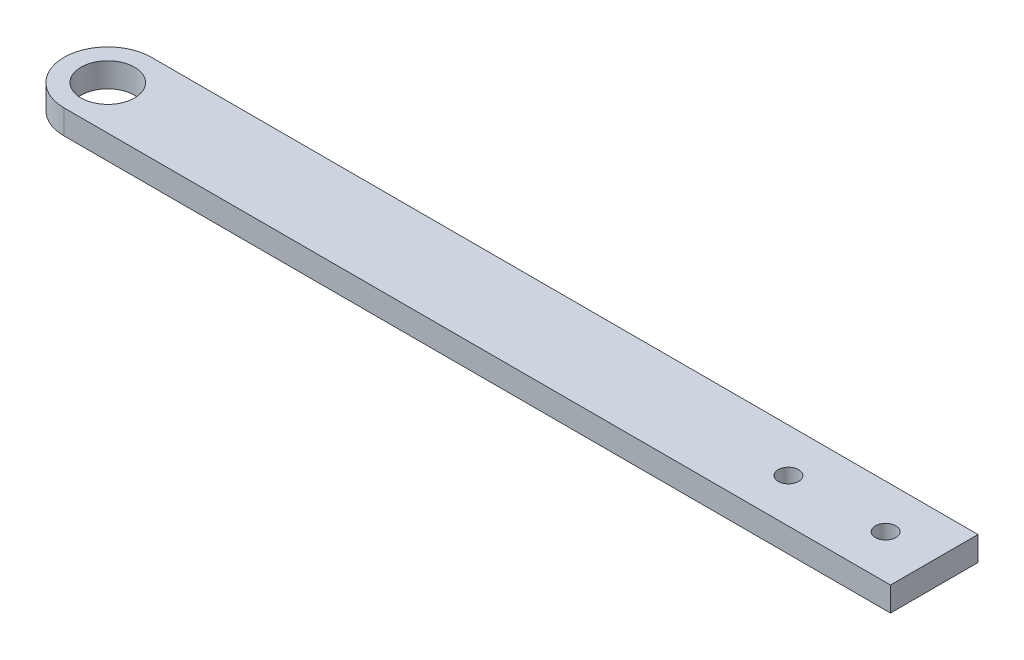
from build123d import *

# Parameters (mm, degrees)
BOSS_EXTRUDE1_DEPTH = 5
SKETCH4_R           = 2.1
CUT_EXTRUDE2_DEPTH  = 180.972220079
SKETCH5_R           = 5.5
CUT_EXTRUDE3_DEPTH  = 180.972220079


with BuildPart() as part:
    # Sketch1 → Boss-Extrude1 (new body)
    with BuildSketch(Plane(origin=(0, 0, 0), x_dir=(1, 0, 0), z_dir=(0, 1, 0))):
        with BuildLine():
            Line((0, 0), (-170, 0))
            ThreePointArc((-170, 0), (-179, -9), (-170, -18))
            Line((-170, -18), (0, -18))
            Line((0, -18), (0, 0))
        make_face()
    extrude(amount=BOSS_EXTRUDE1_DEPTH)

    # Sketch4 → Cut-Extrude2 (cut, through all)
    with BuildSketch(Plane(origin=(0, 5, 0), x_dir=(1, 0, 0), z_dir=(0, 1, 0))):
        with Locations(Location((-10, -9, 0), (0, 0, 270))):
            Circle(SKETCH4_R)
        with Locations(Location((-30, -9, 0), (0, 0, 270))):
            Circle(SKETCH4_R)
    extrude(amount=-CUT_EXTRUDE2_DEPTH, mode=Mode.SUBTRACT)

    # Sketch5 → Cut-Extrude3 (cut, through all)
    with BuildSketch(Plane(origin=(0, 5, 0), x_dir=(1, 0, 0), z_dir=(0, 1, 0))):
        with Locations(Location((-170, -9, 0), (0, 0, 270))):
            Circle(SKETCH5_R)
    extrude(amount=-CUT_EXTRUDE3_DEPTH, mode=Mode.SUBTRACT)


solid = part.part
